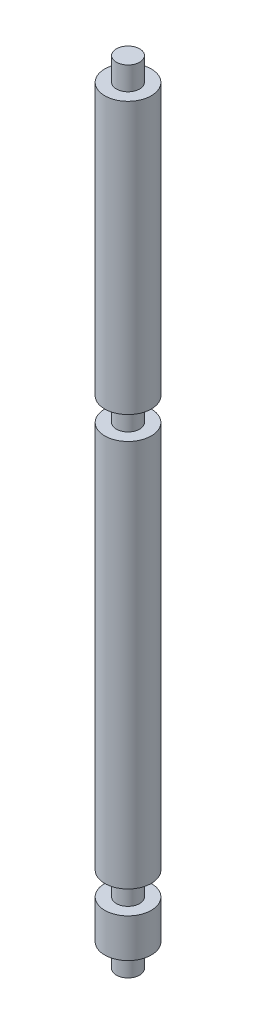
from build123d import *


with BuildPart() as part:
    # Sketch1 → Revolve1 (revolve)
    with BuildSketch(Plane(origin=(0, 0, 0), x_dir=(0, 0, -1), z_dir=(1, 0, 0))):
        Polygon((0, 102), (1.5, 102), (1.5, 99), (3, 99), (3, 64), (1.5, 64), (1.5, 61), (3, 61), (3, 11), (1.5, 11), (1.5, 8), (3, 8), (3, 3), (1.5, 3), (1.5, 0), (0, 0), align=None)
    revolve(axis=Axis((0, 0, 0), (0, 1, 0)))


solid = part.part
